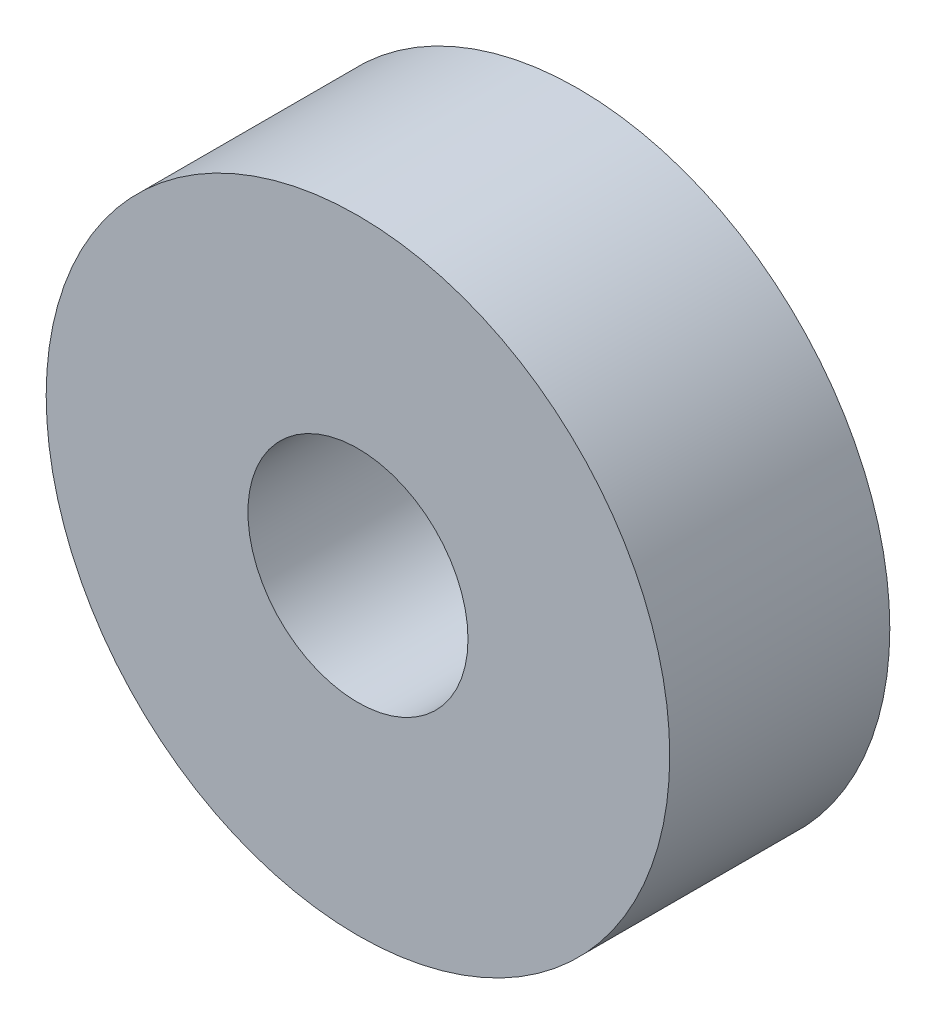
from build123d import *

# Parameters (mm, degrees)
IZIM1_R                     = 8.5
IZIM1_R_2                   = 3
Y_KSEKLIK_EKSTR_ZYON1_DEPTH = 6


with BuildPart() as part:
    # Çizim1 → Yükseklik-Ekstrüzyon1 (new body)
    with BuildSketch(Plane.XY):
        Circle(IZIM1_R)
        Circle(IZIM1_R_2, mode=Mode.SUBTRACT)
    extrude(amount=Y_KSEKLIK_EKSTR_ZYON1_DEPTH)


solid = part.part
